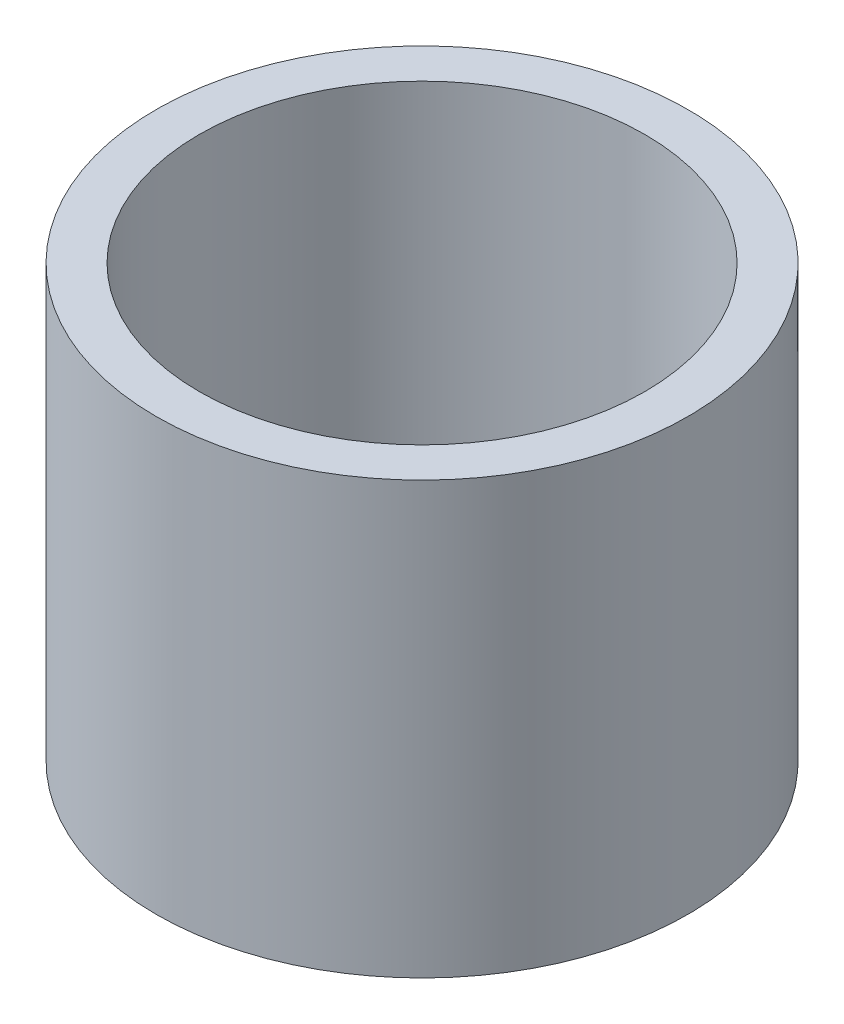
from build123d import *

# Parameters (mm, degrees)
SKETCH1_R           = 18.5
SKETCH1_R_2         = 15.5
BOSS_EXTRUDE1_DEPTH = 30


with BuildPart() as part:
    # Sketch1 → Boss-Extrude1 (new body)
    with BuildSketch(Plane(origin=(0, 0, 0), x_dir=(1, 0, 0), z_dir=(0, 1, 0))):
        with Locations(Location((0, 0, 0), (0, 0, 270))):
            Circle(SKETCH1_R)
        with Locations(Location((0, 0, 0), (0, 0, 270))):
            Circle(SKETCH1_R_2, mode=Mode.SUBTRACT)
    extrude(amount=BOSS_EXTRUDE1_DEPTH)


solid = part.part
